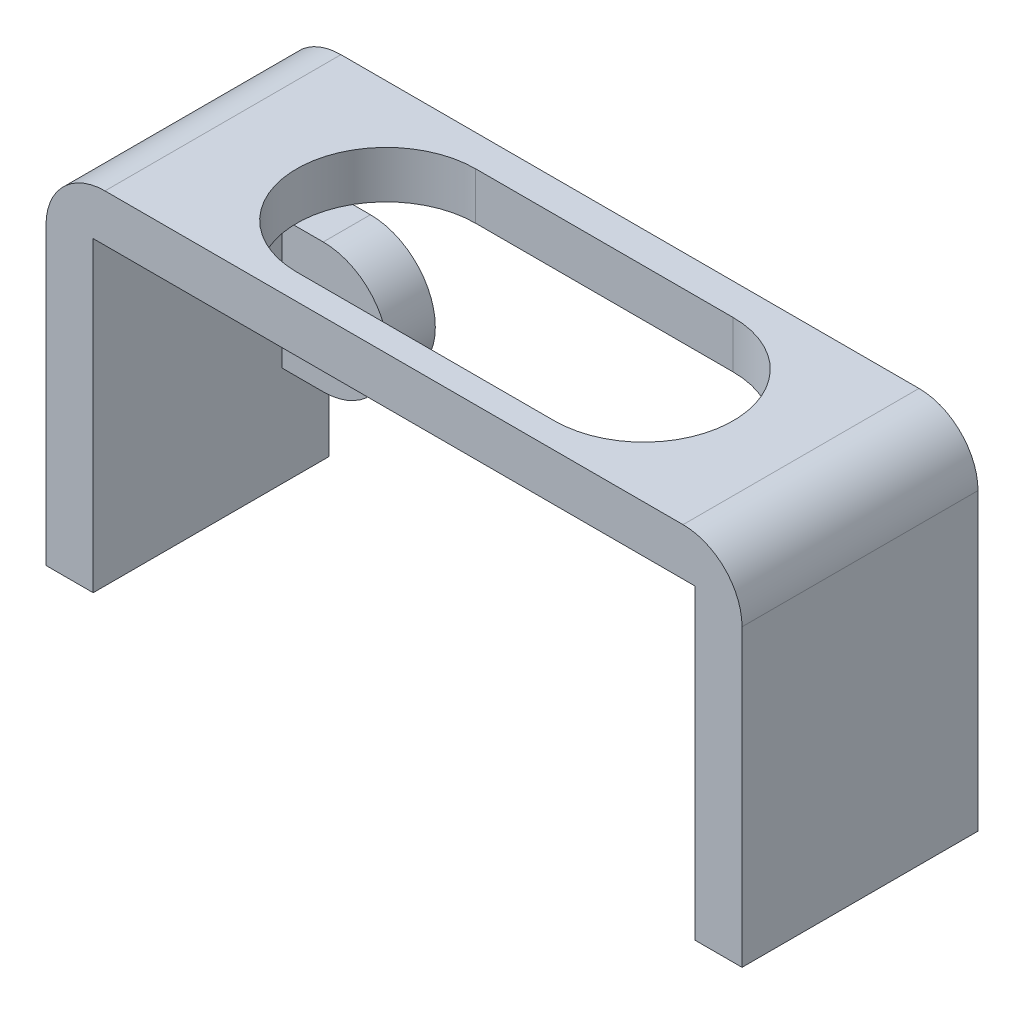
from build123d import *

# Parameters (mm, degrees)
SKETCH_1_R          = 1.5
EXTRUDE_1_DEPTH     = 4
EXTRUDE_1_2_DEPTH   = 4
EXTRUDE_2_DEPTH     = 20
FILLET_2_R          = 5
SKETCH_4_W          = 55
SKETCH_4_H          = 20
EXTRUDE_3_DEPTH     = 2
EXTRUDE_4_DEPTH     = 2
EXTRUDE_5_DEPTH     = 2
CUT_EXTRUDE_2_DEPTH = 7


with BuildPart() as part:
    # 草图1 → 凸台-拉伸1 (new body)
    with BuildSketch(Plane.XY):
        with BuildLine():
            Line((2, 19.5), (2, 8.5))
            Line((2, 8.5), (7.5, 8.5))
            ThreePointArc((7.5, 8.5), (13, 14), (7.5, 19.5))
            Line((7.5, 19.5), (2, 19.5))
        make_face()
        with Locations((7.5, 14)):
            Circle(SKETCH_1_R, mode=Mode.SUBTRACT)
    extrude(amount=EXTRUDE_1_DEPTH)



with BuildPart() as body_2:
    # 草图1 → Extrude 1 2 (new body)
    with BuildSketch(Plane.XY):
        with BuildLine():
            Line((51.5, 8.5), (57, 8.5))
            Line((57, 8.5), (57, 19.5))
            Line((57, 19.5), (51.5, 19.5))
            ThreePointArc((51.5, 19.5), (46, 14), (51.5, 8.5))
        make_face()
        with Locations((51.5, 14)):
            Circle(SKETCH_1_R, mode=Mode.SUBTRACT)
    extrude(amount=EXTRUDE_1_2_DEPTH)


with BuildPart() as part_1:
    add(part.part)

    add(body_2.part)  # 凸台-拉伸2 merges body 2
    # 草图1<3> → 凸台-拉伸2 (add)
    with BuildSketch(Plane.XY):
        Polygon((0, 30), (0, 0), (2, 0), (2, 8.5), (2, 19.5), (2, 28), (57, 28), (57, 19.5), (57, 8.5), (57, 0), (59, 0), (59, 30), align=None)
    extrude(amount=EXTRUDE_2_DEPTH)

    # 圆角2
    fillet_2_edges = [part_1.edges().sort_by_distance(p)[0] for p in [
        (59, 30, 10),
        (0, 30, 10),
    ]]
    fillet(fillet_2_edges, radius=FILLET_2_R)

    # 草图4 → 凸台-拉伸3 (add)
    with BuildSketch(Plane.XZ.offset(-28)):
        with Locations((29.5, 10)):
            Rectangle(SKETCH_4_W, SKETCH_4_H)
    extrude(amount=EXTRUDE_3_DEPTH)

    # 草图5 → 凸台-拉伸4 (add)
    with BuildSketch(Plane(origin=(2, 0, 0), x_dir=(0, 0, -1), z_dir=(1, 0, 0))):
        Polygon((0, 8.5), (-4, 8.5), (-4, 19.5), (0, 19.5), (0, 26), (-20, 26), (-20, 0), (0, 0), align=None)
    extrude(amount=EXTRUDE_4_DEPTH)

    # 草图7 → 凸台-拉伸5 (add)
    with BuildSketch(Plane.ZY.offset(-57)):
        Polygon((0, 19.5), (4, 19.5), (4, 8.5), (0, 8.5), (0, 0), (20, 0), (20, 26), (0, 26), align=None)
    extrude(amount=EXTRUDE_5_DEPTH)

    # 草图8 → 切除-拉伸2 (cut)
    with BuildSketch(Plane(origin=(0, 30, 0), x_dir=(1, 0, 0), z_dir=(0, 1, 0))):
        with BuildLine():
            Line((40.92, -17.832853898), (19.082552531, -17.832853898))
            ThreePointArc((19.082552531, -17.832853898), (11.500622297, -10.250923663), (19.082552531, -2.668993429))
            Line((19.082552531, -2.668993429), (40.92, -2.668993429))
            ThreePointArc((40.92, -2.668993429), (48.501930234, -10.250923663), (40.92, -17.832853898))
        make_face()
    extrude(amount=-CUT_EXTRUDE_2_DEPTH, mode=Mode.SUBTRACT)


solid = part_1.part
